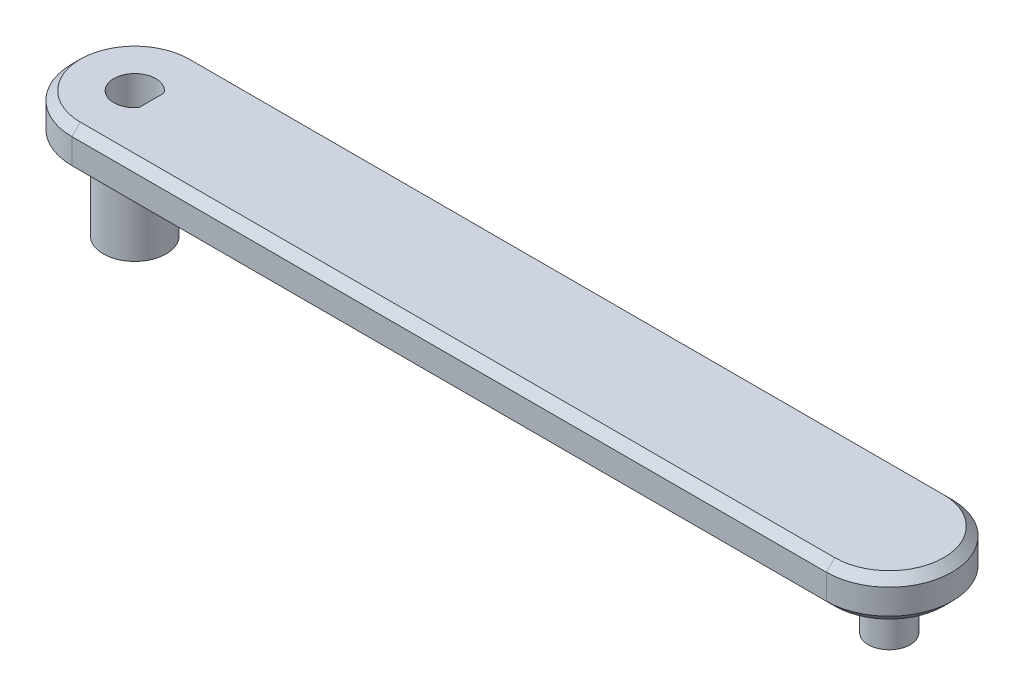
from build123d import *

# Parameters (mm, degrees)
EXTRUDE_2_DEPTH          = 10
CHAMFER_1_SIZE           = 2
SKETCH_9_R               = 7.5
EXTRUDE_7_DEPTH          = 20
CUT_EXTRUDE_3_DEPTH      = 24
CUT_EXTRUDE_3_DEPTH_BACK = 197.596032513
SKETCH_11_R              = 5
EXTRUDE_8_DEPTH          = 12


with BuildPart() as part:
    # 草图1 → 凸台-拉伸2 (new body)
    with BuildSketch(Plane(origin=(0, 0, 0), x_dir=(1, 0, 0), z_dir=(0, 1, 0))):
        with BuildLine():
            Line((0, 15), (180, 15))
            ThreePointArc((180, 15), (195, 0), (180, -15))
            Line((180, -15), (0, -15))
            ThreePointArc((0, -15), (-15, 0), (0, 15))
        make_face()
    extrude(amount=EXTRUDE_2_DEPTH)

    # 倒角1
    chamfer_1_edges = [part.edges().sort_by_distance(p)[0] for p in [
        (90, 10, -15),
        (-15, 10, 0),
        (90, 10, 15),
        (-15, 0, 0),
        (90, 0, -15),
        (195, 0, 0),
        (90, 0, 15),
        (195, 10, 0),
    ]]
    chamfer(chamfer_1_edges, length=CHAMFER_1_SIZE)

    # 草图9 → 凸台-拉伸7 (add)
    with BuildSketch(Plane.XZ):
        with Locations(Location((0, 0, 0), (0, 0, 90))):
            Circle(SKETCH_9_R)
    extrude(amount=EXTRUDE_7_DEPTH)

    # 草图4 → 切除-拉伸3 (cut, two sides: drawn at the far end of the back side and taken through both)
    with BuildSketch(Plane.XZ.offset(-CUT_EXTRUDE_3_DEPTH_BACK)):
        with BuildLine():
            Line((4, 3), (4, -3))
            ThreePointArc((4, -3), (-5, 0), (4, 3))
        make_face()
    extrude(amount=CUT_EXTRUDE_3_DEPTH + CUT_EXTRUDE_3_DEPTH_BACK, mode=Mode.SUBTRACT)

    # 草图11 → 凸台-拉伸8 (add)
    with BuildSketch(Plane.XZ):
        with Locations(Location((180, 0, 0), (0, 0, 90))):
            Circle(SKETCH_11_R)
    extrude(amount=EXTRUDE_8_DEPTH)


solid = part.part
